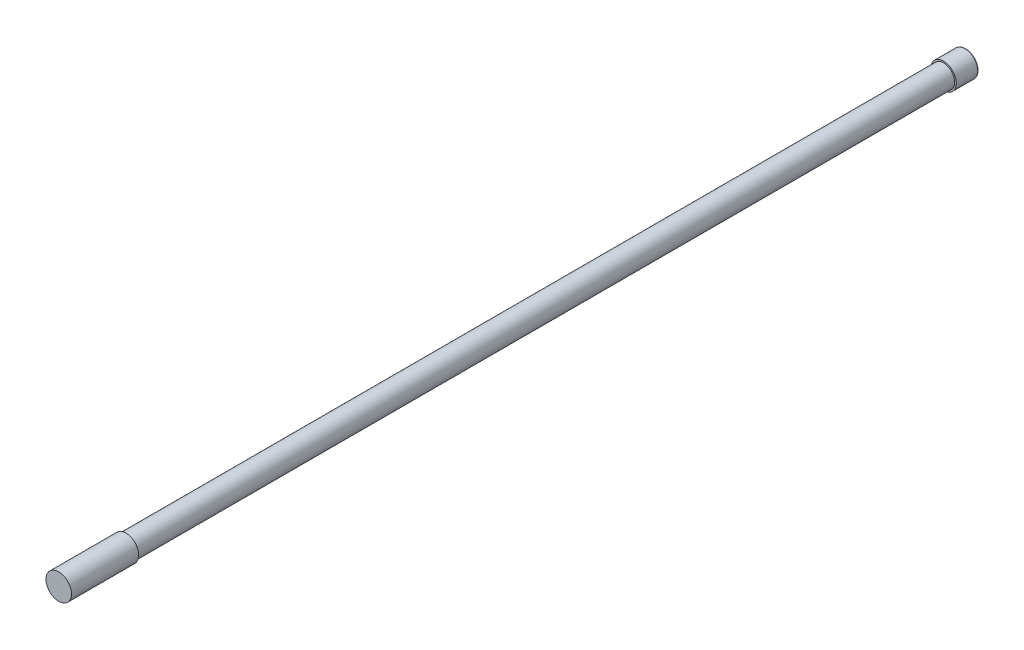
from build123d import *

# Parameters (mm, degrees)
ESQUISSE1_R        = 11.4
BOSS_EXTRU_1_DEPTH = 60
ESQUISSE2_R        = 10
BOSS_EXTRU_2_DEPTH = 750
ESQUISSE3_R        = 11.4
BOSS_EXTRU_3_DEPTH = 20
CONG_1_R           = 1


with BuildPart() as part:
    # Esquisse1 → Boss.-Extru.1 (new body)
    with BuildSketch(Plane.XY):
        Circle(ESQUISSE1_R)
    extrude(amount=BOSS_EXTRU_1_DEPTH)

    # Esquisse2 → Boss.-Extru.2 (add)
    with BuildSketch(Plane(origin=(0, 0, 0), x_dir=(-1, 0, 0), z_dir=(0, 0, -1))):
        Circle(ESQUISSE2_R)
    extrude(amount=BOSS_EXTRU_2_DEPTH)

    # Esquisse3 → Boss.-Extru.3 (add)
    with BuildSketch(Plane(origin=(0, 0, -750), x_dir=(-1, 0, 0), z_dir=(0, 0, -1))):
        with Locations(Location((0, 0, 0), (0, 0, 180))):
            Circle(ESQUISSE3_R)
    extrude(amount=-BOSS_EXTRU_3_DEPTH)

    # Congé1
    cong_1_edges = [part.edges().sort_by_distance(p)[0] for p in [
        (-11.4, 0, -750),
    ]]
    fillet(cong_1_edges, radius=CONG_1_R)


solid = part.part
